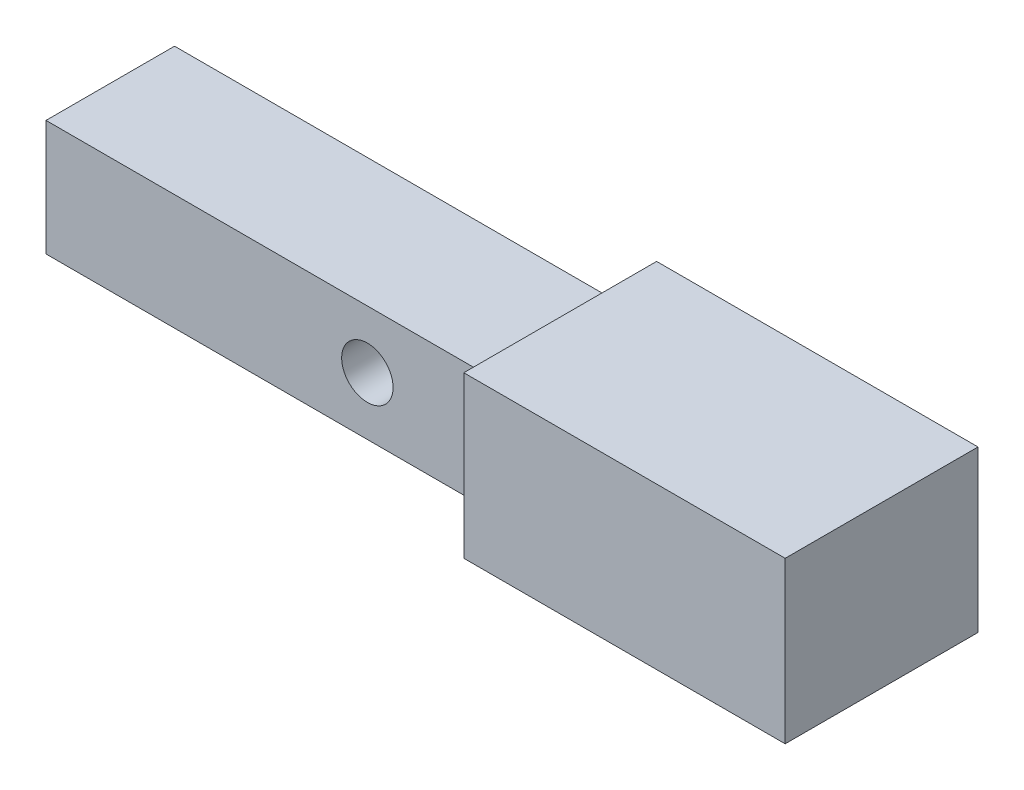
from build123d import *

# Parameters (mm, degrees)
SKETCH1_W           = 100
SKETCH1_H           = 18
SKETCH1_R           = 4
BOSS_EXTRUDE1_DEPTH = 20
SKETCH2_W           = 50
SKETCH2_H           = 25
BOSS_EXTRUDE2_DEPTH = 15


with BuildPart() as part:
    # Sketch1 → Boss-Extrude1 (new body)
    with BuildSketch(Plane.XY):
        Rectangle(SKETCH1_W, SKETCH1_H)
        Circle(SKETCH1_R, mode=Mode.SUBTRACT)
    extrude(amount=BOSS_EXTRUDE1_DEPTH)

    # Sketch2 → Boss-Extrude2 (add, symmetric)
    with BuildSketch(Plane.XY.offset(10)):
        with Locations((45, 0)):
            Rectangle(SKETCH2_W, SKETCH2_H)
    extrude(amount=BOSS_EXTRUDE2_DEPTH, both=True)


solid = part.part
